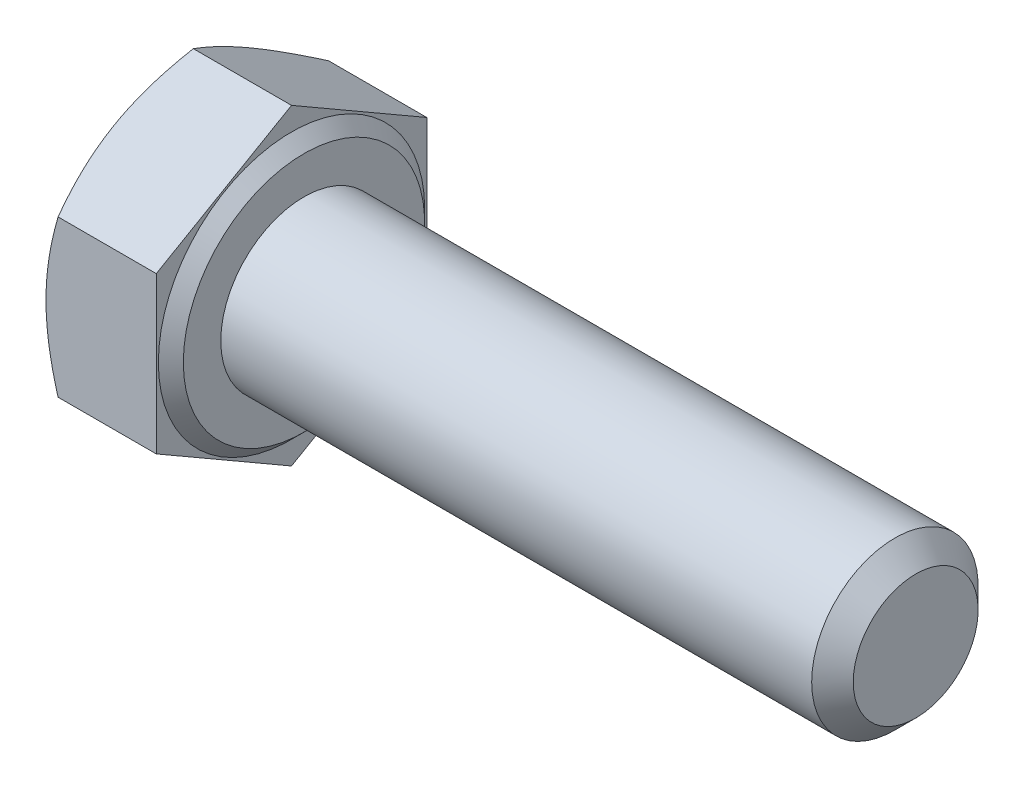
from build123d import *

# Parameters (mm, degrees)
EXTRUDE_1_DEPTH = 2.65
CHAMFER_2_SIZE  = 1


with BuildPart() as part:
    # 草图1 → 拉伸1 (new, symmetric)
    with BuildSketch(Plane(origin=(0, 0, 0), x_dir=(0, 0, 1), z_dir=(1, 0, 0))):
        Polygon((0, 7.505553499), (-6.5, 3.75277675), (-6.5, -3.75277675), (0, -7.505553499), (6.5, -3.75277675), (6.5, 3.75277675), align=None)
    extrude(amount=EXTRUDE_1_DEPTH, both=True)

    # 草图2 → 切除-旋转2 (revolve, cut)
    with BuildSketch(Plane.XY):
        Polygon((-2.65, 6.5), (0.034663773, 11.149974056), (-2.65, 11.149974056), align=None)
    revolve(axis=Axis((-3.243026821, 0, 0), (1, 0, 0)), mode=Mode.SUBTRACT)

    # 草图3 → 旋转1 (revolve)
    with BuildSketch(Plane.XY, mode=Mode.PRIVATE) as revolve_1_sk:
        Polygon((2.65, 0), (2.65, 6.4), (3.25, 5.8), (3.25, 4), (32.65, 4), (32.65, 0), align=None)
    revolve(revolve_1_sk.sketch.rotate(Axis((-4.543756915, 0, 0), (1, 0, 0)), 90), axis=Axis((-4.543756915, 0, 0), (1, 0, 0)))

    # 倒角2
    chamfer_2_edges = [part.edges().sort_by_distance(p)[0] for p in [
        (32.65, 0, -4),
    ]]
    chamfer(chamfer_2_edges, length=CHAMFER_2_SIZE)


solid = part.part
